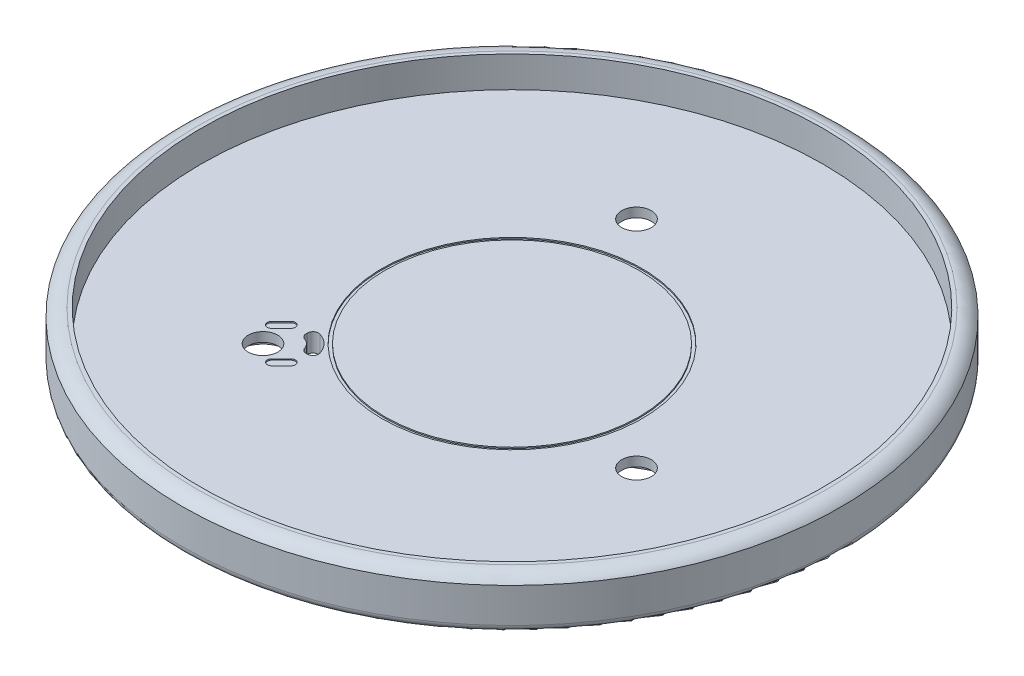
from build123d import *

# Parameters (mm, degrees)
SKETCH_1_R          = 50.2
EXTRUDE_1_DEPTH     = 3
SKETCH_3_R          = 53.2
SKETCH_3_R_2        = 50.2
EXTRUDE_2_DEPTH     = 8
SKETCH_4_R          = 21
SKETCH_4_R_2        = 20.5
CUT_EXTRUDE_1_DEPTH = 0.2
FILLET_2_R          = 1.2
CUT_EXTRUDE_2_DEPTH = 1.5
CUT_EXTRUDE_3_DEPTH = 10
CUT_EXTRUDE_4_DEPTH = 0.2
SKETCH_9_R          = 2.38
CUT_EXTRUDE_5_DEPTH = 10
CUT_EXTRUDE_6_DEPTH = 0.8


with BuildPart() as part:
    # 草图1 → 凸台-拉伸1 (new body)
    with BuildSketch(Plane(origin=(0, 0, 0), x_dir=(1, 0, 0), z_dir=(0, 1, 0))):
        with Locations(Location((0, 0, 0), (0, 0, 270))):
            Circle(SKETCH_1_R)
    extrude(amount=EXTRUDE_1_DEPTH)

    # 草图3 → 凸台-拉伸2 (add)
    with BuildSketch(Plane.XZ):
        with Locations(Location((0, 0, 0), (0, 0, 270))):
            Circle(SKETCH_3_R)
        with Locations(Location((0, 0, 0), (0, 0, 270))):
            Circle(SKETCH_3_R_2, mode=Mode.SUBTRACT)
    extrude(amount=-EXTRUDE_2_DEPTH)

    # 草图4 → 切除-拉伸1 (cut)
    with BuildSketch(Plane(origin=(0, 3, 0), x_dir=(1, 0, 0), z_dir=(0, 1, 0))):
        with Locations(Location((0, 0, 0), (0, 0, 270))):
            Circle(SKETCH_4_R)
        with Locations(Location((0, 0, 0), (0, 0, 270))):
            Circle(SKETCH_4_R_2, mode=Mode.SUBTRACT)
    extrude(amount=-CUT_EXTRUDE_1_DEPTH, mode=Mode.SUBTRACT)

    # 草图5 → 切除-旋转1 (revolve, cut)
    with BuildSketch(Plane(origin=(0, 0, 0), x_dir=(0, 0, -1), z_dir=(1, 0, 0))):
        with BuildLine():
            Line((53.2, 6.8), (53.2, 8))
            Line((53.2, 8), (50.8, 8))
            ThreePointArc((50.8, 8), (52.141640786, 7.683281573), (53.2, 6.8))
        make_face()
    revolve(axis=Axis((0, 0, 0), (0, 1, 0)), mode=Mode.SUBTRACT)

    # 圆角2
    fillet_2_edges = [part.edges().sort_by_distance(p)[0] for p in [
        (0, 0, 53.2),
    ]]
    fillet(fillet_2_edges, radius=FILLET_2_R)

    # 草图6 → 切除-拉伸2 (cut)
    with BuildSketch(Plane.XZ):
        with BuildLine():
            Line((-7.784609691, -34.516660498), (-7.091789368, -34.116660498))
            Line((-7.091789368, -34.116660498), (-3.986078552, -29.842016281))
            ThreePointArc((-3.986078552, -29.842016281), (-3.22762839, -27.700219097), (-3.758044914, -25.490875272))
            Line((-3.758044914, -25.490875272), (-4.856406461, -23.588457268))
            ThreePointArc((-4.856406461, -23.588457268), (-6.070819178, -22.656605616), (-7.588457268, -22.856406461))
            Line((-7.588457268, -22.856406461), (-9.490875272, -23.954768007))
            ThreePointArc((-9.490875272, -23.954768007), (-11.054901368, -25.602907623), (-11.468962853, -27.836983475))
            Line((-11.468962853, -27.836983475), (-10.916660498, -33.091789368))
            Line((-10.916660498, -33.091789368), (-10.516660498, -33.784609691))
            ThreePointArc((-10.516660498, -33.784609691), (-9.302247781, -34.716461343), (-7.784609691, -34.516660498))
        make_face()
        with BuildLine():
            Line((33.784609691, 10.516660498), (33.091789368, 10.916660498))
            Line((33.091789368, 10.916660498), (27.836983475, 11.468962853))
            ThreePointArc((27.836983475, 11.468962853), (25.602907623, 11.054901368), (23.954768007, 9.490875272))
            Line((23.954768007, 9.490875272), (22.856406461, 7.588457268))
            ThreePointArc((22.856406461, 7.588457268), (22.656605616, 6.070819178), (23.588457268, 4.856406461))
            Line((23.588457268, 4.856406461), (25.490875272, 3.758044914))
            ThreePointArc((25.490875272, 3.758044914), (27.700219097, 3.22762839), (29.842016281, 3.986078552))
            Line((29.842016281, 3.986078552), (34.116660498, 7.091789368))
            Line((34.116660498, 7.091789368), (34.516660498, 7.784609691))
            ThreePointArc((34.516660498, 7.784609691), (34.716461343, 9.302247781), (33.784609691, 10.516660498))
        make_face()
        with BuildLine():
            Line((-26, 24), (-26, 23.2))
            Line((-26, 23.2), (-23.850904924, 18.373053428))
            ThreePointArc((-23.850904924, 18.373053428), (-22.375279233, 16.645317728), (-20.196723093, 16))
            Line((-20.196723093, 16), (-18, 16))
            ThreePointArc((-18, 16), (-16.585786438, 16.585786438), (-16, 18))
            Line((-16, 18), (-16, 20.196723093))
            ThreePointArc((-16, 20.196723093), (-16.645317728, 22.375279233), (-18.373053428, 23.850904924))
            Line((-18.373053428, 23.850904924), (-23.2, 26))
            Line((-23.2, 26), (-24, 26))
            ThreePointArc((-24, 26), (-25.414213562, 25.414213562), (-26, 24))
        make_face()
    extrude(amount=-CUT_EXTRUDE_2_DEPTH, mode=Mode.SUBTRACT)

    # 草图7 → 切除-拉伸3 (cut)
    with BuildSketch(Plane.XZ):
        with BuildLine():
            Line((-18, 15.033520605), (-18, 15.24319025))
            ThreePointArc((-18, 15.24319025), (-17.828484492, 15.771688447), (-17.379310345, 16.098751896))
            ThreePointArc((-17.379310345, 16.098751896), (-16.585786438, 16.585786438), (-16.098751896, 17.379310345))
            ThreePointArc((-16.098751896, 17.379310345), (-15.771688447, 17.828484492), (-15.24319025, 18))
            Line((-15.24319025, 18), (-15.033520605, 18))
            ThreePointArc((-15.033520605, 18), (-14.310623209, 17.636115057), (-14.172284652, 16.838709677))
            ThreePointArc((-14.172284652, 16.838709677), (-15.171572875, 15.171572875), (-16.838709677, 14.172284652))
            ThreePointArc((-16.838709677, 14.172284652), (-17.636115057, 14.310623209), (-18, 15.033520605))
        make_face()
    extrude(amount=-CUT_EXTRUDE_3_DEPTH, mode=Mode.SUBTRACT)

    # 草图8 → 切除-拉伸4 (cut)
    with BuildSketch(Plane(origin=(0, 3, 0), x_dir=(1, 0, 0), z_dir=(0, 1, 0))):
        with BuildLine():
            ThreePointArc((-20.952735217, -14.730195543), (-19.962785724, -14.730195543), (-19.962785724, -15.720145037))
            Line((-19.962785724, -15.720145037), (-21.518420642, -17.275779955))
            ThreePointArc((-21.518420642, -17.275779955), (-22.508370136, -17.275779955), (-22.508370136, -16.285830462))
            Line((-22.508370136, -16.285830462), (-20.952735217, -14.730195543))
        make_face()
        with BuildLine():
            Line((-16.285830462, -22.508370136), (-14.730195543, -20.952735217))
            ThreePointArc((-14.730195543, -20.952735217), (-14.730195543, -19.962785724), (-15.720145037, -19.962785724))
            Line((-15.720145037, -19.962785724), (-17.275779955, -21.518420642))
            ThreePointArc((-17.275779955, -21.518420642), (-17.275779955, -22.508370136), (-16.285830462, -22.508370136))
        make_face()
    extrude(amount=-CUT_EXTRUDE_4_DEPTH, mode=Mode.SUBTRACT)

    # 草图9 → 切除-拉伸5 (cut)
    with BuildSketch(Plane(origin=(0, 3, 0), x_dir=(1, 0, 0), z_dir=(0, 1, 0))):
        with Locations(Location((-20.098361546, -20.098361546, 0), (0, 0, 270))):
            Circle(SKETCH_9_R)
        with Locations(Location((-7.3565109, 27.454872447, 0), (0, 0, 270))):
            Circle(SKETCH_9_R)
        with Locations(Location((27.454872447, -7.3565109, 0), (0, 0, 270))):
            Circle(SKETCH_9_R)
    extrude(amount=-CUT_EXTRUDE_5_DEPTH, mode=Mode.SUBTRACT)

    # 草图10 → 切除-拉伸6 (cut)
    # profile 1 of 3: a face of its own
    with BuildSketch(Plane.XZ):
        Polygon((-12.037559463, 3.134013413), (-12.97798915, 4.0744431), (-11.3537704, 5.69866185), (-15.637559463, 9.982450913), (-16.061192275, 7.1400681), (-17.270567275, 8.3494431), (-16.910215713, 10.861357163), (-15.644590713, 12.126982163), (-10.2850204, 6.76741185), (-8.9772079, 8.07522435), (-8.036778213, 7.134794663), align=None)
    # profile 2 of 3: a face of its own
    with BuildSketch(Plane.XZ):
        with BuildLine():
            add(Edge.make_bspline(
                [(-4.908638, 10.037934875), (-5.009234328, 9.943106496), (-5.204816247, 9.75873877), (-5.523133437, 9.526378084), (-5.852277945, 9.345047596), (-6.189378556, 9.214212403), (-6.529935767, 9.131639194), (-6.871114308, 9.102088761), (-7.210911091, 9.119364063), (-7.547740809, 9.186918969), (-7.878472134, 9.303271954), (-8.196703516, 9.472168946), (-8.506728353, 9.685011642), (-8.692549949, 9.8611847), (-8.788130188, 9.951802063)],
                knots=[0, 0, 0, 0, 1.136115981, 2.208865351, 3.231062099, 4.218092323, 5.174148399, 6.102954762, 7.024583534, 7.962990089, 8.918560302, 9.897073085, 10.918326705, 12, 12, 12, 12], degree=3))
            Line((-8.788130188, 9.951802063), (-11.519770813, 12.683442688))
            add(Edge.make_bspline(
                [(-11.519770813, 12.683442688), (-11.610388176, 12.779022927), (-11.786561233, 12.964844522), (-11.999403929, 13.274869359), (-12.168300921, 13.593100741), (-12.284653906, 13.923832066), (-12.352208812, 14.260661785), (-12.369484114, 14.600458567), (-12.339933681, 14.941637108), (-12.257360472, 15.282194319), (-12.126525279, 15.61929493), (-11.945194792, 15.948439438), (-11.712834105, 16.266756628), (-11.528466379, 16.462338547), (-11.433638, 16.562934875)],
                knots=[0, 0, 0, 0, 1.081673295, 2.102926915, 3.081439698, 4.037009911, 4.975416466, 5.897045238, 6.825851601, 7.781907677, 8.768937901, 9.791134649, 10.863884019, 12, 12, 12, 12], degree=3))
            add(Edge.make_bspline(
                [(-11.433638, 16.562934875), (-11.332585847, 16.658519865), (-11.136935958, 16.843584628), (-10.816828994, 17.074336322), (-10.488710446, 17.255449728), (-10.152437235, 17.386988545), (-9.812316833, 17.469192562), (-9.471185192, 17.498741132), (-9.13129372, 17.481702432), (-8.794450085, 17.413110076), (-8.462094097, 17.300301817), (-8.143890896, 17.130239797), (-7.833769098, 16.917675449), (-7.647961196, 16.741463082), (-7.552388, 16.6508255)],
                knots=[0, 0, 0, 0, 1.142688929, 2.212391883, 3.234380344, 4.216718667, 5.172579933, 6.101197039, 7.022638017, 7.960853358, 8.919188188, 9.897501586, 10.918547111, 12, 12, 12, 12], degree=3))
            Line((-7.552388, 16.6508255), (-4.820747375, 13.919184875))
            add(Edge.make_bspline(
                [(-4.820747375, 13.919184875), (-4.730109793, 13.823611679), (-4.553897426, 13.637803777), (-4.341333078, 13.327681979), (-4.171271059, 13.009478778), (-4.0584628, 12.677122791), (-3.989870443, 12.340279155), (-3.972831743, 12.000387684), (-4.002380313, 11.659256042), (-4.084584331, 11.319135641), (-4.216123147, 10.982862429), (-4.397236554, 10.654743881), (-4.627988247, 10.334636918), (-4.81305301, 10.138987028), (-4.908638, 10.037934875)],
                knots=[0, 0, 0, 0, 1.081452889, 2.102498414, 3.080811812, 4.039146642, 4.977361983, 5.898802961, 6.827420067, 7.783281333, 8.765619656, 9.787608117, 10.857311071, 12, 12, 12, 12], degree=3))
        make_face()
        with BuildLine():
            add(Edge.make_bspline(
                [(-5.849067688, 10.978364563), (-5.814016352, 11.015421664), (-5.745446006, 11.087915857), (-5.652922608, 11.201764472), (-5.577227552, 11.321055218), (-5.514076003, 11.441503129), (-5.463445931, 11.564230957), (-5.428951442, 11.690086373), (-5.404755139, 11.818216589), (-5.399146705, 11.948670712), (-5.403608152, 12.078806491), (-5.42289612, 12.207450492), (-5.457156678, 12.33253363), (-5.502097397, 12.45546494), (-5.565574405, 12.573055214), (-5.63886808, 12.689774058), (-5.727749708, 12.802966822), (-5.79514301, 12.873830588), (-5.82973175, 12.9102005)],
                knots=[0, 0, 0, 0, 1.123174975, 2.197248608, 3.224495634, 4.228712617, 5.189549244, 6.14133267, 7.098088556, 8.054322242, 9.009946336, 9.962516613, 10.910882808, 11.862316313, 12.837685189, 13.847111187, 14.895057655, 16, 16, 16, 16], degree=3))
            Line((-5.82973175, 12.9102005), (-8.561372375, 15.641841125))
            add(Edge.make_bspline(
                [(-8.561372375, 15.641841125), (-8.597687855, 15.676517576), (-8.668445564, 15.744081775), (-8.782256189, 15.831641758), (-8.895896298, 15.909057537), (-9.015337035, 15.968590192), (-9.137079478, 16.016265534), (-9.261576311, 16.052518991), (-9.389305572, 16.07074651), (-9.518178693, 16.078504017), (-9.647316816, 16.07141928), (-9.775240315, 16.050152059), (-9.900656402, 16.014501671), (-10.024894324, 15.965383398), (-10.145501451, 15.898908163), (-10.266360854, 15.822261871), (-10.381886133, 15.727847667), (-10.455560022, 15.658131191), (-10.493208313, 15.622505188)],
                knots=[0, 0, 0, 0, 1.102832843, 2.148778623, 3.152483981, 4.120095036, 5.074329331, 6.024295658, 6.962314458, 7.903862974, 8.858271066, 9.798321073, 10.7482874, 11.719235203, 12.727556838, 13.770644404, 14.860771026, 16, 16, 16, 16], degree=3))
            add(Edge.make_bspline(
                [(-10.493208313, 15.622505188), (-10.528852203, 15.584865845), (-10.598603682, 15.511209466), (-10.692767629, 15.395558995), (-10.770158336, 15.275377156), (-10.833480822, 15.153254243), (-10.885799554, 15.030445732), (-10.920669786, 14.904466648), (-10.942224396, 14.776623101), (-10.948984404, 14.647509935), (-10.942220106, 14.518365868), (-10.920420998, 14.391946333), (-10.887814381, 14.266884164), (-10.836890084, 14.146855859), (-10.77821047, 14.026875627), (-10.700528308, 13.913332205), (-10.61304298, 13.799494483), (-10.545468279, 13.728740586), (-10.510786438, 13.692427063)],
                knots=[0, 0, 0, 0, 1.139956555, 2.230779399, 3.274533144, 4.277473055, 5.253900326, 6.204473361, 7.14512374, 8.100141376, 9.042291223, 9.982941603, 10.917658897, 11.877273619, 12.84550265, 13.849849036, 14.896462821, 16, 16, 16, 16], degree=3))
            Line((-10.510786438, 13.692427063), (-7.779145813, 10.960786438))
            add(Edge.make_bspline(
                [(-7.779145813, 10.960786438), (-7.742775961, 10.926197316), (-7.671912312, 10.858803272), (-7.558718713, 10.769926927), (-7.442002862, 10.69661432), (-7.324401934, 10.633204691), (-7.201509138, 10.588020414), (-7.076753933, 10.554788266), (-6.9491415, 10.532138363), (-6.819339388, 10.528640429), (-6.688937695, 10.534019648), (-6.560752128, 10.558180774), (-6.434541164, 10.593189893), (-6.311183766, 10.642439729), (-6.191480638, 10.70712362), (-6.072421884, 10.782128419), (-5.958631244, 10.874767307), (-5.886128936, 10.94332149), (-5.849067688, 10.978364563)],
                knots=[0, 0, 0, 0, 1.105645508, 2.154258869, 3.164327246, 4.140316827, 5.092355806, 6.041325522, 6.983773033, 7.940005267, 8.896847481, 9.854212228, 10.80660135, 11.780025458, 12.773452361, 13.801353106, 14.876110259, 16, 16, 16, 16], degree=3))
        make_face(mode=Mode.SUBTRACT)
    # profile 3 of 3: a face of its own
    with BuildSketch(Plane.XZ):
        with BuildLine():
            add(Edge.make_bspline(
                [(-7.608638, 12.737934875), (-7.651256611, 12.698710765), (-7.73301792, 12.623461607), (-7.873279883, 12.54168025), (-8.018203691, 12.487694034), (-8.16934756, 12.470503309), (-8.321211655, 12.486581229), (-8.47020421, 12.537159501), (-8.614072417, 12.624792434), (-8.69924171, 12.703455987), (-8.744184875, 12.744966125)],
                knots=[0, 0, 0, 0, 1.078468522, 2.068978668, 3.010058665, 3.94623103, 4.881188457, 5.839340878, 6.859837199, 8, 8, 8, 8], degree=3))
            add(Edge.make_bspline(
                [(-8.744184875, 12.744966125), (-8.785233415, 12.78925952), (-8.863322293, 12.873521264), (-8.947568353, 13.016548129), (-8.997754113, 13.162534161), (-9.010484523, 13.311713585), (-8.985994948, 13.459047947), (-8.931885497, 13.602089875), (-8.847753742, 13.739872198), (-8.77269123, 13.820819782), (-8.733638, 13.862934875)],
                knots=[0, 0, 0, 0, 1.139675049, 2.168066075, 3.114402787, 4.037609751, 4.968766405, 5.91575196, 6.91561558, 8, 8, 8, 8], degree=3))
            add(Edge.make_bspline(
                [(-8.733638, 13.862934875), (-8.691525218, 13.902008653), (-8.610582076, 13.977110658), (-8.472768963, 14.060968658), (-8.330462231, 14.115801259), (-8.183503055, 14.13691015), (-8.034430978, 14.127565039), (-7.887689062, 14.07708753), (-7.744237552, 13.992637243), (-7.659967181, 13.914536517), (-7.61566925, 13.87348175)],
                knots=[0, 0, 0, 0, 1.084786176, 2.085020238, 3.032356643, 3.951234827, 4.873918182, 5.831130674, 6.85990271, 8, 8, 8, 8], degree=3))
            add(Edge.make_bspline(
                [(-7.61566925, 13.87348175), (-7.574159023, 13.828535613), (-7.4954953, 13.743360689), (-7.407572114, 13.599052296), (-7.356993228, 13.449375218), (-7.343334103, 13.2973048), (-7.360761281, 13.147351169), (-7.411902681, 13.0021877), (-7.49432828, 12.86237687), (-7.569469929, 12.780574756), (-7.608638, 12.737934875)],
                knots=[0, 0, 0, 0, 1.140905902, 2.162067331, 3.131221777, 4.065699465, 4.991612349, 5.929672876, 6.920828586, 8, 8, 8, 8], degree=3))
        make_face()
    extrude(amount=-CUT_EXTRUDE_6_DEPTH, mode=Mode.SUBTRACT)


solid = part.part
